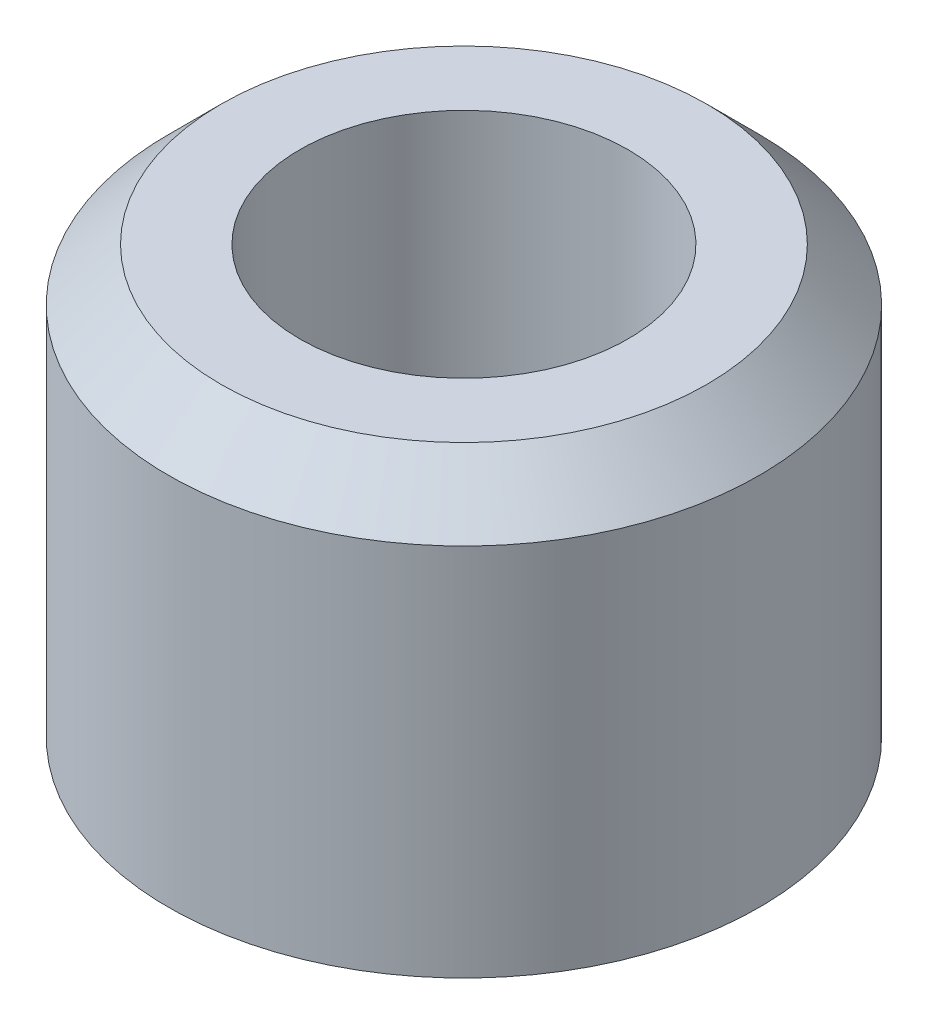
from build123d import *

# Parameters (mm, degrees)
SKETCH_1_R      = 4.5
SKETCH_1_R_2    = 2.5
EXTRUDE_1_DEPTH = 6.5
CHAMFER_1_SIZE  = 0.8


with BuildPart() as part:
    # Эскиз1 → Бобышка-Вытянуть1 (new body)
    with BuildSketch(Plane(origin=(0, 0, 0), x_dir=(1, 0, 0), z_dir=(0, 1, 0))):
        with Locations(Location((0, 0, 0), (0, 0, 90))):
            Circle(SKETCH_1_R)
        with Locations(Location((0, 0, 0), (0, 0, 90))):
            Circle(SKETCH_1_R_2, mode=Mode.SUBTRACT)
    extrude(amount=EXTRUDE_1_DEPTH)

    # Фаска1
    chamfer_1_edges = [part.edges().sort_by_distance(p)[0] for p in [
        (0, 6.5, 4.5),
    ]]
    chamfer(chamfer_1_edges, length=CHAMFER_1_SIZE)


solid = part.part
